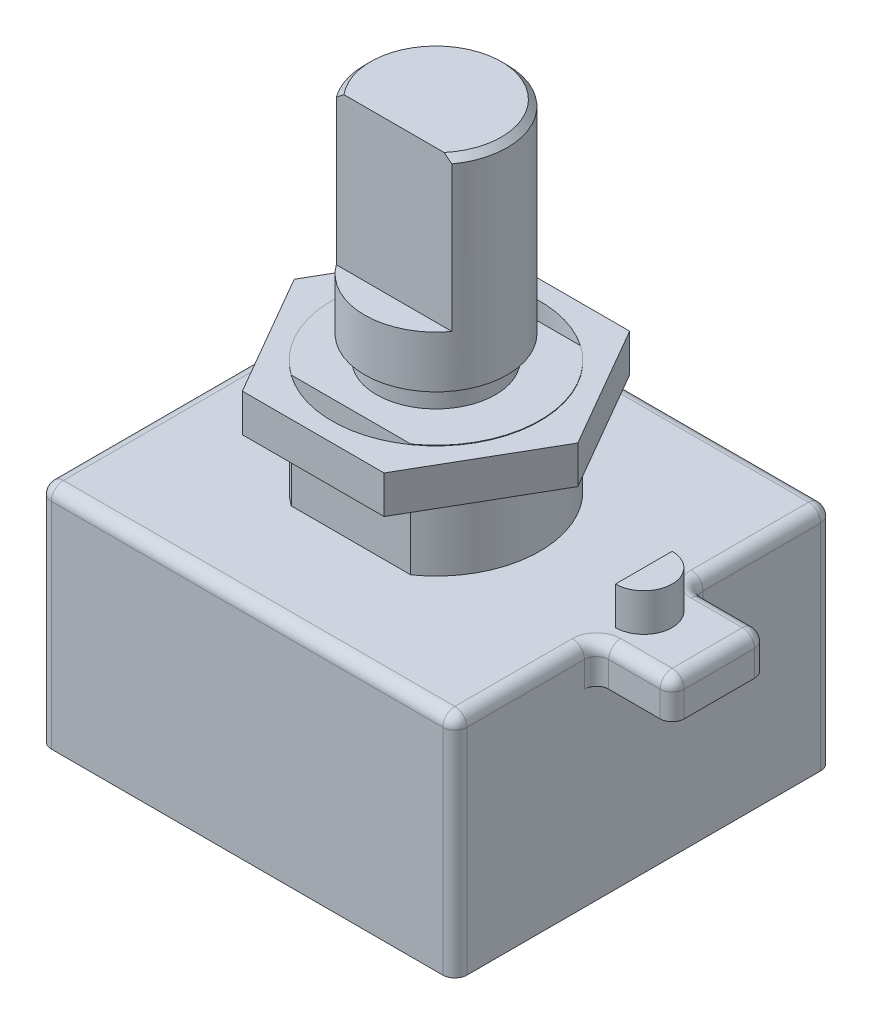
from build123d import *

# Parameters (mm, degrees)
SKETCH1_W                           = 17.4625
SKETCH1_H                           = 15.875
BOSS_EXTRUDE1_DEPTH                 = 9.525
SKETCH2_R                           = 4.365625
BOSS_EXTRUDE2_DEPTH                 = 4.7625
CUT_EXTRUDE1_START                  = -4.7625
CUT_EXTRUDE1_DEPTH                  = 4.7625
BOSS_EXTRUDE3_START                 = -0.0254
SKETCH4_R                           = 4.365625
BOSS_EXTRUDE3_DEPTH                 = 1.5875
CUT_EXTRUDE2_REACH                  = 28.553
CUT_EXTRUDE2_END_RADIUS             = 3
SKETCH6_W                           = 1.2375
SKETCH6_H                           = 6.35
CUT_EXTRUDE2_DIRECTION_2_REACH      = 28.553
CUT_EXTRUDE2_DIRECTION_2_END_RADIUS = 3
CHAMFER1_SIZE                       = 0.254
SKETCH7_W                           = 3.175
SKETCH7_H                           = 3.96875
BOSS_EXTRUDE4_DEPTH                 = 1.5875
BOSS_EXTRUDE5_DEPTH                 = 1.5875
FILLET1_R                           = 0.508


with BuildPart() as part:
    # Sketch1 → Boss-Extrude1 (new body)
    with BuildSketch(Plane(origin=(0, 0, 0), x_dir=(1, 0, 0), z_dir=(0, 1, 0))):
        Rectangle(SKETCH1_W, SKETCH1_H)
    extrude(amount=BOSS_EXTRUDE1_DEPTH)

    # Sketch2 → Boss-Extrude2 (add)
    with BuildSketch(Plane(origin=(0, 9.525, 0), x_dir=(1, 0, 0), z_dir=(0, 1, 0))):
        with Locations(Location((0, 0, 0), (0, 0, 90))):
            Circle(SKETCH2_R)
    extrude(amount=BOSS_EXTRUDE2_DEPTH)

    # Sketch3 → Cut-Extrude1 (cut)
    with BuildSketch(Plane(origin=(0, 14.2875, 0), x_dir=(1, 0, 0), z_dir=(0, 1, 0)).offset(CUT_EXTRUDE1_START)):
        with BuildLine():
            Line((-2.510057893, -3.571875), (2.510057893, -3.571875))
            ThreePointArc((2.510057893, -3.571875), (0, -4.365625), (-2.510057893, -3.571875))
        make_face()
        with BuildLine():
            Line((-2.510057893, 3.571875), (2.510057893, 3.571875))
            ThreePointArc((2.510057893, 3.571875), (0, 4.365625), (-2.510057893, 3.571875))
        make_face()
    extrude(amount=CUT_EXTRUDE1_DEPTH, mode=Mode.SUBTRACT)



with BuildPart() as body_2:
    # Sketch4 → Boss-Extrude3 (new body)
    with BuildSketch(Plane(origin=(0, 14.2875, 0), x_dir=(1, 0, 0), z_dir=(0, 1, 0)).offset(BOSS_EXTRUDE3_START)):
        Polygon((2.978766545, 5.159375), (-2.978766545, 5.159375), (-5.95753309, 0), (-2.978766545, -5.159375), (2.978766545, -5.159375), (5.95753309, 0), align=None)
        with Locations(Location((0, 0, 0), (0, 0, 270))):
            Circle(SKETCH4_R, mode=Mode.SUBTRACT)
    extrude(amount=-BOSS_EXTRUDE3_DEPTH)


with BuildPart() as part_1:
    add(part.part)

    add(body_2.part)  # Revolve1 merges body 2
    # Sketch5 → Revolve1 (revolve)
    with BuildSketch(Plane(origin=(0, 0, 0), x_dir=(0, 0, -1), z_dir=(1, 0, 0))):
        Polygon((-2.5, 14.2621), (-2.5, 15.2621), (-3, 15.2621), (-3, 23.7871), (0, 23.7871), (0, 14.2621), align=None)
    revolve(axis=Axis((0, 14.2621, 0), (0, -1, 0)))

    # Cut-Extrude2: up to this cylinder (the profile starts inside it)
    cut_extrude2_end = Plane(origin=(0, 20.6121, 0), z_dir=(0, 1, 0)) * Cylinder(CUT_EXTRUDE2_END_RADIUS, 64.106, mode=Mode.PRIVATE)
    # Sketch6 → Cut-Extrude2 (cut, up to the surface)
    with BuildSketch(Plane(origin=(0, 0, 0), x_dir=(0, 0, -1), z_dir=(1, 0, 0)), mode=Mode.PRIVATE) as cut_extrude2_sk1:
        with Locations((-2.38125, 20.6121)):
            Rectangle(SKETCH6_W, SKETCH6_H)
    cut_extrude2_tool1 = extrude(cut_extrude2_sk1.sketch, amount=-CUT_EXTRUDE2_REACH, mode=Mode.PRIVATE) & cut_extrude2_end
    add(cut_extrude2_tool1.solids().sort_by_distance((0, 20.6121, 2.38125))[0], mode=Mode.SUBTRACT)

    # Cut-Extrude2 direction 2: up to this cylinder (the profile starts inside it)
    cut_extrude2_direction_2_end = Plane(origin=(0, 20.6121, 0), z_dir=(0, 1, 0)) * Cylinder(CUT_EXTRUDE2_DIRECTION_2_END_RADIUS, 64.106, mode=Mode.PRIVATE)
    # Sketch6 → Cut-Extrude2 direction 2 (cut, up to the surface)
    with BuildSketch(Plane(origin=(0, 0, 0), x_dir=(0, 0, -1), z_dir=(1, 0, 0)), mode=Mode.PRIVATE) as cut_extrude2_direction_2_sk1:
        with Locations((-2.38125, 20.6121)):
            Rectangle(SKETCH6_W, SKETCH6_H)
    cut_extrude2_direction_2_tool1 = extrude(cut_extrude2_direction_2_sk1.sketch, amount=CUT_EXTRUDE2_DIRECTION_2_REACH, mode=Mode.PRIVATE) & cut_extrude2_direction_2_end
    add(cut_extrude2_direction_2_tool1.solids().sort_by_distance((0, 20.6121, 2.38125))[0], mode=Mode.SUBTRACT)

    # Chamfer1
    chamfer1_edges = [part_1.edges().sort_by_distance(p)[0] for p in [
        (0, 23.7871, -3),
    ]]
    chamfer(chamfer1_edges, length=CHAMFER1_SIZE)

    # Sketch7 → Boss-Extrude4 (add)
    with BuildSketch(Plane(origin=(0, 9.525, 0), x_dir=(1, 0, 0), z_dir=(0, 1, 0))):
        with Locations((10.31875, 0)):
            Rectangle(SKETCH7_W, SKETCH7_H)
    extrude(amount=-BOSS_EXTRUDE4_DEPTH)

    # Sketch8 → Boss-Extrude5 (add)
    with BuildSketch(Plane(origin=(0, 9.525, 0), x_dir=(1, 0, 0), z_dir=(0, 1, 0))):
        with BuildLine():
            Line((8.73125, 1.190625), (8.73125, -1.190625))
            ThreePointArc((8.73125, -1.190625), (9.921875, 0), (8.73125, 1.190625))
        make_face()
    extrude(amount=BOSS_EXTRUDE5_DEPTH)

    # Fillet1
    fillet1_edges = [part_1.edges().sort_by_distance(p)[0] for p in [
        (-8.73125, 9.525, 0),
        (0, 9.525, 7.9375),
        (8.73125, 9.525, 4.9609375),
        (0, 9.525, -7.9375),
        (8.73125, 4.7625, 7.9375),
        (-8.73125, 4.7625, 7.9375),
        (-8.73125, 4.7625, -7.9375),
        (8.73125, 4.7625, -7.9375),
        (8.73125, 9.525, -4.9609375),
        (8.73125, 8.73125, 1.984375),
        (8.73125, 8.73125, -1.984375),
        (11.90625, 8.73125, -1.984375),
        (11.90625, 8.73125, 1.984375),
        (10.31875, 9.525, 1.984375),
        (11.90625, 9.525, 0),
        (10.31875, 9.525, -1.984375),
    ]]
    fillet(fillet1_edges, radius=FILLET1_R)


solid = part_1.part
